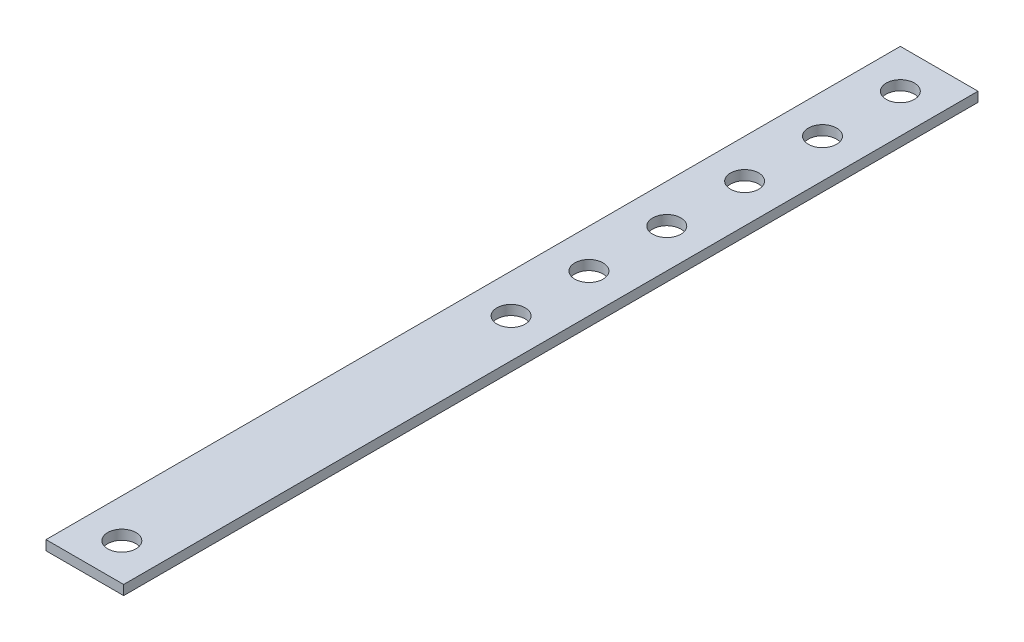
from build123d import *

# Parameters (mm, degrees)
SKETCH1_W           = 12.7
SKETCH1_H           = 139.7
SKETCH1_R           = 2.31
BOSS_EXTRUDE1_DEPTH = 1.5875


with BuildPart() as part:
    # Sketch1 → Boss-Extrude1 (new body)
    with BuildSketch(Plane(origin=(0, 0, 0), x_dir=(1, 0, 0), z_dir=(0, 1, 0))):
        with Locations((6.312912156, 31.687542426)):
            Rectangle(SKETCH1_W, SKETCH1_H)
        with Locations(Location((6.312912156, 95.187542426, 0), (0, 0, 270))):
            Circle(SKETCH1_R, mode=Mode.SUBTRACT)
        with Locations(Location((6.312912156, 31.537542426, 0), (0, 0, 270))):
            Circle(SKETCH1_R, mode=Mode.SUBTRACT)
        with Locations(Location((6.312912156, -32.112457574, 0), (0, 0, 270))):
            Circle(SKETCH1_R, mode=Mode.SUBTRACT)
        with Locations(Location((6.312912156, 82.457542426, 0), (0, 0, 270))):
            Circle(SKETCH1_R, mode=Mode.SUBTRACT)
        with Locations(Location((6.312912156, 69.727542426, 0), (0, 0, 270))):
            Circle(SKETCH1_R, mode=Mode.SUBTRACT)
        with Locations(Location((6.312912156, 56.997542426, 0), (0, 0, 270))):
            Circle(SKETCH1_R, mode=Mode.SUBTRACT)
        with Locations(Location((6.312912156, 44.267542426, 0), (0, 0, 270))):
            Circle(SKETCH1_R, mode=Mode.SUBTRACT)
    extrude(amount=BOSS_EXTRUDE1_DEPTH)


solid = part.part
